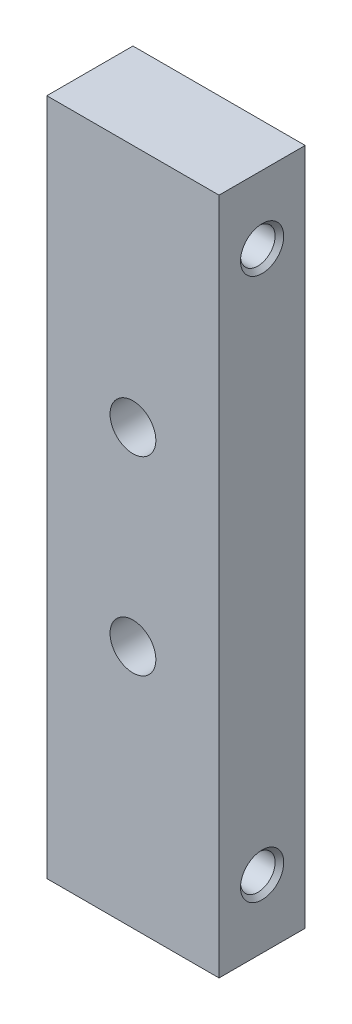
from build123d import *

# Parameters (mm, degrees)
CROQUIS1_W                         = 25.4
CROQUIS1_H                         = 100
SALIENTE_EXTRUIR1_DEPTH            = 6.35
TALADRO_DE_MARGEN_PARA_1_41_D      = 6.7564
TALADRO_ROSCADO_1_4_202_AT_2_COUNT = 2
TALADRO_ROSCADO_1_4_202_AT_2_PITCH = 80


with BuildPart() as part:
    # Croquis1 → Saliente-Extruir1 (new, symmetric)
    with BuildSketch(Plane.XY):
        Rectangle(CROQUIS1_W, CROQUIS1_H)
    extrude(amount=SALIENTE_EXTRUIR1_DEPTH, both=True)

    # Taladro de margen para 1/41 (through all)
    with Locations(Plane(origin=(-6.35, 0, 6.35), x_dir=(-1, 0, 0), z_dir=(0, 0, 1))):
        with Locations((-6.35, 14), (-6.35, -14)):
            Hole(TALADRO_DE_MARGEN_PARA_1_41_D / 2)

    # Croquis7 → Taladro roscado 1/4-202 (revolve, cut)
    with BuildSketch(Plane(origin=(-12.7, 40, 0), x_dir=(0, 0, 1), z_dir=(0, 1, 0))):
        Polygon((0, 0), (0, 25.4), (3.1877, 25.4), (2.5527, 24.765), (2.5527, 0.635), (3.1877, 0), align=None)
    taladro_roscado_1_4_202 = revolve(axis=Axis((-19.05, 40, 0), (1, 0, 0)), mode=Mode.SUBTRACT)

    # Taladro roscado 1/4-202 at 2: Taladro roscado 1/4-202 ×2
    with Locations(*[(0, -i * TALADRO_ROSCADO_1_4_202_AT_2_PITCH, 0) for i in range(1, TALADRO_ROSCADO_1_4_202_AT_2_COUNT)]):
        add(taladro_roscado_1_4_202, mode=Mode.SUBTRACT)


solid = part.part
